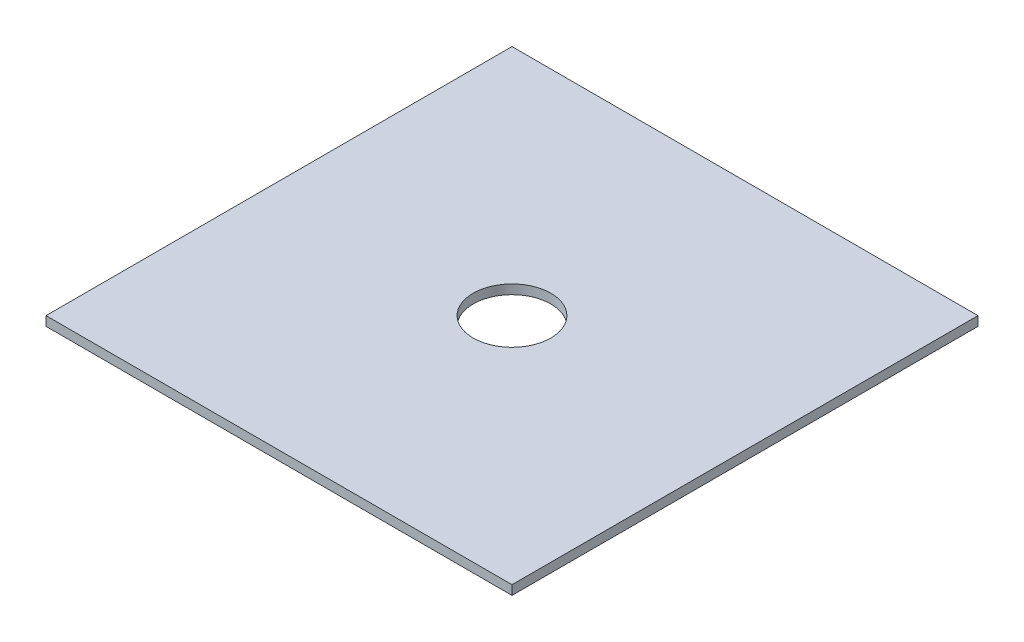
from build123d import *

# Parameters (mm, degrees)
SKETCH1_W           = 150
SKETCH1_H           = 150
BOSS_EXTRUDE1_DEPTH = 3
SKETCH2_R           = 12.5
CUT_EXTRUDE1_DEPTH  = 3


with BuildPart() as part:
    # Sketch1 → Boss-Extrude1 (new body)
    with BuildSketch(Plane(origin=(0, 0, 0), x_dir=(1, 0, 0), z_dir=(0, 1, 0))):
        Rectangle(SKETCH1_W, SKETCH1_H)
    extrude(amount=BOSS_EXTRUDE1_DEPTH)

    # Sketch2 → Cut-Extrude1 (cut)
    with BuildSketch(Plane(origin=(0, 3, 0), x_dir=(1, 0, 0), z_dir=(0, 1, 0))):
        with Locations(Location((0, 0, 0), (0, 0, 270))):
            Circle(SKETCH2_R)
    extrude(amount=-CUT_EXTRUDE1_DEPTH, mode=Mode.SUBTRACT)


solid = part.part
